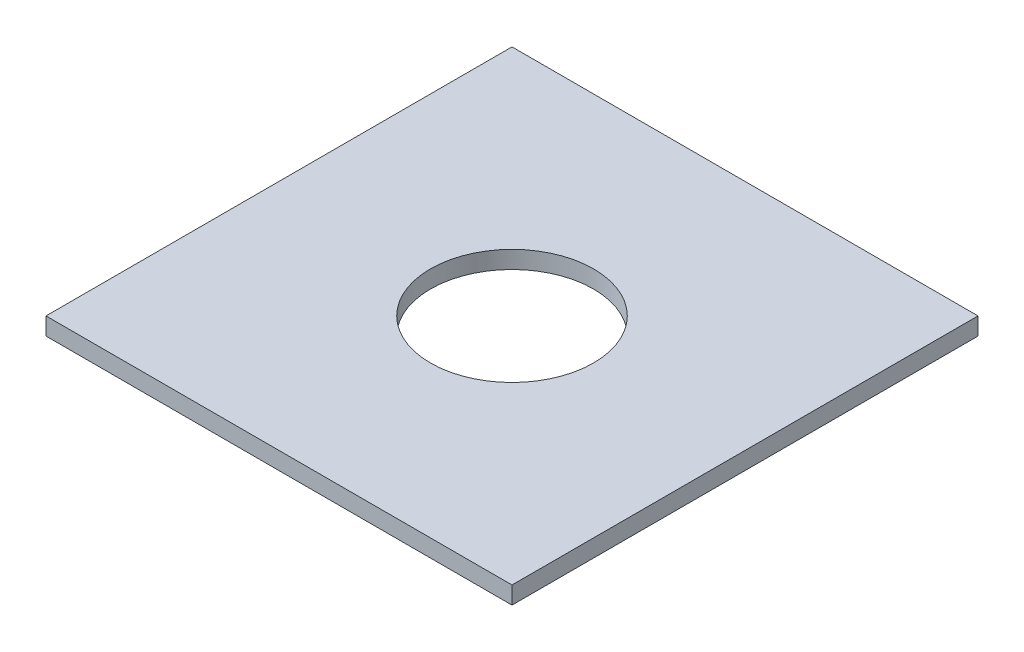
from build123d import *

# Parameters (mm, degrees)
SKETCH_1_W      = 80
SKETCH_1_H      = 80
SKETCH_1_R      = 14
EXTRUDE_1_DEPTH = 3


with BuildPart() as part:
    # 草图1 → 凸台-拉伸1 (new body)
    with BuildSketch(Plane(origin=(0, 0, 0), x_dir=(1, 0, 0), z_dir=(0, 1, 0))):
        Rectangle(SKETCH_1_W, SKETCH_1_H)
        with Locations(Location((0, 0, 0), (0, 0, 270))):
            Circle(SKETCH_1_R, mode=Mode.SUBTRACT)
    extrude(amount=EXTRUDE_1_DEPTH)


solid = part.part
